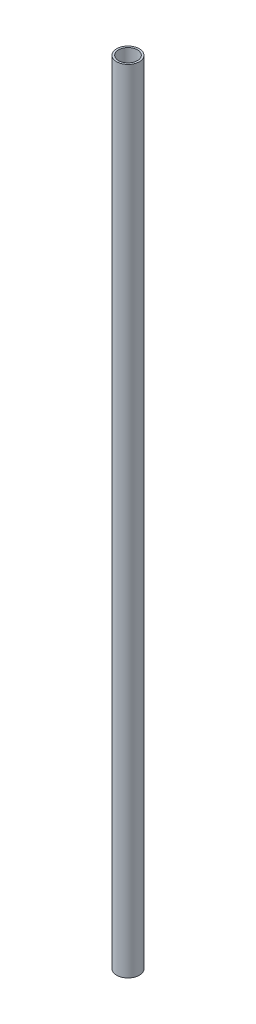
from build123d import *

# Parameters (mm, degrees)
SKETCH1_R           = 6
SKETCH1_R_2         = 5
BOSS_EXTRUDE1_DEPTH = 420


with BuildPart() as part:
    # Sketch1 → Boss-Extrude1 (new body)
    with BuildSketch(Plane(origin=(0, 0, 0), x_dir=(1, 0, 0), z_dir=(0, 1, 0))):
        with Locations(Location((0, 0, 0), (0, 0, 270))):
            Circle(SKETCH1_R)
        with Locations(Location((0, 0, 0), (0, 0, 270))):
            Circle(SKETCH1_R_2, mode=Mode.SUBTRACT)
    extrude(amount=BOSS_EXTRUDE1_DEPTH)


solid = part.part
